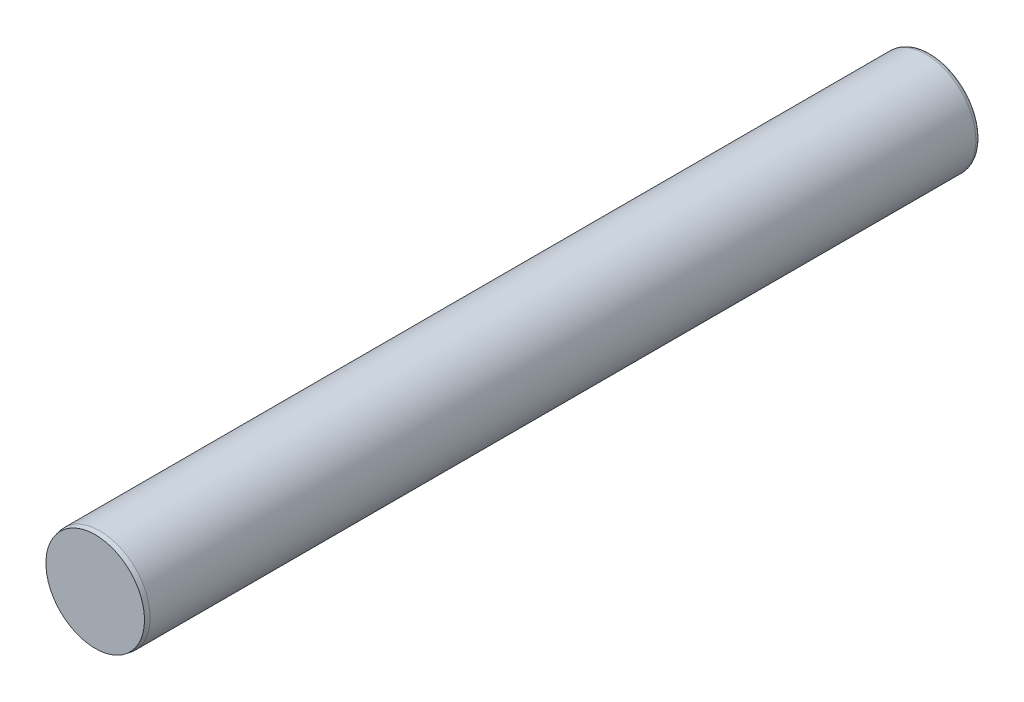
from build123d import *


with BuildPart() as part:
    # Sketch1 → Revolve1 (revolve)
    with BuildSketch(Plane(origin=(0, 0, 0), x_dir=(0, 0, -1), z_dir=(1, 0, 0)), mode=Mode.PRIVATE) as revolve1_sk:
        with BuildLine():
            Line((0, 0), (0, 5.9))
            Line((0, 5.9), (0.567128182, 6))
            Line((0.567128182, 6), (99.4, 6))
            ThreePointArc((99.4, 6), (99.824264069, 5.824264069), (100, 5.4))
            Line((100, 5.4), (100, 0))
            Line((100, 0), (0, 0))
        make_face()
    revolve(revolve1_sk.sketch.rotate(Axis((0, 0, 0), (0, 0, -1)), 90), axis=Axis((0, 0, 0), (0, 0, -1)))


solid = part.part
